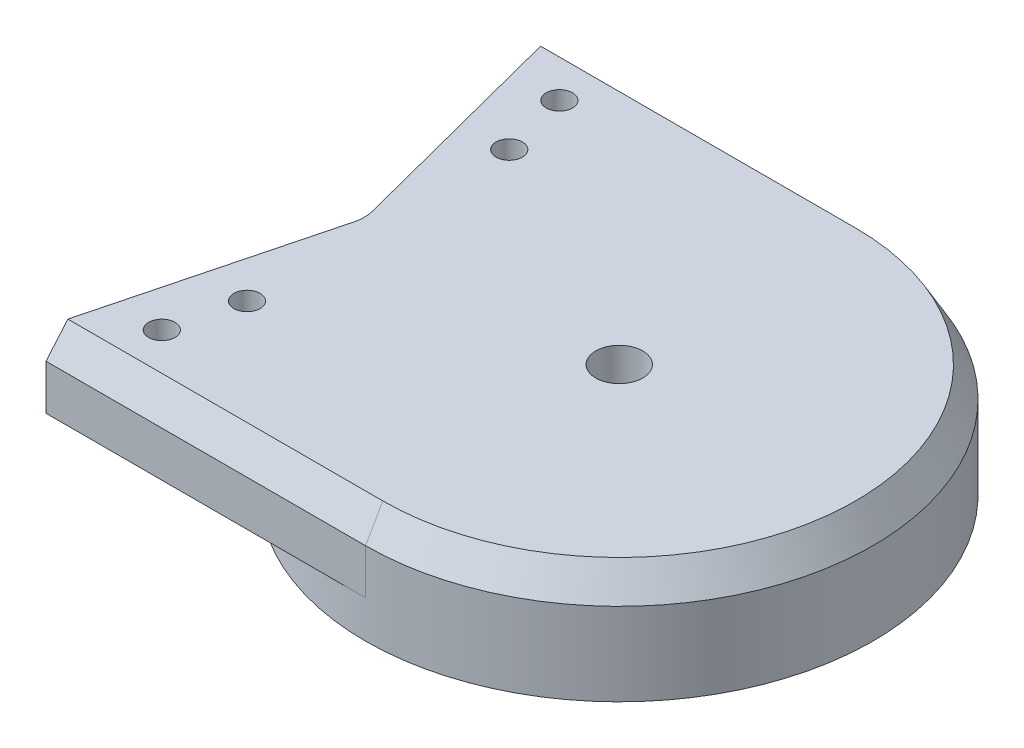
from build123d import *
from OCP.BRepFilletAPI import BRepFilletAPI_MakeChamfer

# Parameters (mm, degrees)
SALIENTE_EXTRUIR2_DEPTH     = 23
CROQUIS7_R                  = 20
CORTAR_EXTRUIR1_DEPTH       = 16
CROQUIS8_R                  = 10.25
CORTAR_EXTRUIR2_DEPTH       = 65.838641661
SALIENTE_EXTRUIR3_START     = 32
CROQUIS9_R                  = 20
CROQUIS9_R_2                = 3.075
CROQUIS9_R_3                = 10.25
SALIENTE_EXTRUIR3_DEPTH     = 32
CORTAR_EXTRUIR3_START       = -7
CROQUIS10_R                 = 20
CORTAR_EXTRUIR3_DEPTH       = 112.607172695
SALIENTE_EXTRUIR4_START     = 20
CROQUIS11_R                 = 3.075
CROQUIS11_R_2               = 20
SALIENTE_EXTRUIR4_DEPTH     = 20
CROQUIS12_R                 = 63
CORTAR_EXTRUIR4_DEPTH       = 3
CROQUIS13_R                 = 55
CORTAR_EXTRUIR5_DEPTH       = 10
SALIENTE_EXTRUIR5_START     = 10
SALIENTE_EXTRUIR5_DEPTH     = 10
CHAFL_N1_SIZE               = 8
CHAFL_N1_SIZE2              = 4.618802154
CROQUIS15_R                 = 6.25
CORTAR_EXTRUIR6_DEPTH       = 226.641862251
CORTAR_EXTRUIR7_REACH       = 233.334
CROQUIS17_R                 = 1.5
CORTAR_EXTRUIR9_REACH       = 225.907
CROQUIS19_R                 = 1.5
CORTAR_EXTRUIR10_START      = -50
CORTAR_EXTRUIR10_DEPTH      = 50
CORTAR_EXTRUIR11_DEPTH      = 50
CROQUIS22_R                 = 3
CORTAR_EXTRUIR12_DEPTH      = 3
CROQUIS23_R                 = 3
CORTAR_EXTRUIR13_DEPTH      = 3
CROQUIS25_R                 = 2.5
CORTAR_EXTRUIR15_DEPTH      = 30
CROQUIS24_R                 = 2.5
CORTAR_EXTRUIR14_DEPTH      = 30
CROQUIS26_R                 = 2
CORTAR_EXTRUIR16_DEPTH      = 223.070371729
CROQUIS27_R                 = 3.5
CORTAR_EXTRUIR17_DEPTH      = 5
CORTAR_EXTRUIR18_DEPTH      = 3.25
CORTAR_EXTRUIR20_DEPTH      = 223.070371729
CORTAR_EXTRUIR20_DEPTH_BACK = 10
CROQUIS31_R                 = 2.5
CORTAR_EXTRUIR21_DEPTH      = 217.079267863
CROQUIS32_R                 = 4.5
CORTAR_EXTRUIR22_DEPTH      = 5
SALIENTE_EXTRUIR6_START     = 4
CROQUIS33_R                 = 55
CROQUIS33_R_2               = 6.25
SALIENTE_EXTRUIR6_DEPTH     = 4
SALIENTE_EXTRUIR7_START     = 3.35
CROQUIS34_R                 = 16.85
CROQUIS34_R_2               = 6.25
SALIENTE_EXTRUIR7_DEPTH     = 3.35
SALIENTE_EXTRUIR8_START     = 29
CROQUIS35_R                 = 10
CROQUIS35_R_2               = 6.25
SALIENTE_EXTRUIR8_DEPTH     = 29
CORTAR_EXTRUIR23_DEPTH      = 218.721088781
CROQUIS37_R                 = 42.5
CROQUIS37_R_2               = 25
CORTAR_EXTRUIR24_DEPTH      = 8


with BuildPart() as part:
    # Croquis2 → Saliente-Extruir2 (new body)
    with BuildSketch(Plane(origin=(0, 0, 0), x_dir=(1, 0, 0), z_dir=(0, 1, 0))):
        with BuildLine():
            Line((32.725022686, -35), (-35, -35))
            Line((-35, -35), (-35, 35))
            Line((-35, 35), (38, 35))
            Line((38, 35), (52.182846342, -19.705264464))
            ThreePointArc((52.182846342, -19.705264464), (38.869791903, -20.762030653), (32.5, -32.5))
            ThreePointArc((32.5, -32.5), (32.556369153, -33.755053307), (32.725022686, -35))
        make_face()
    extrude(amount=SALIENTE_EXTRUIR2_DEPTH)

    # Croquis7 → Cortar-Extruir1 (cut)
    with BuildSketch(Plane(origin=(0, 23, 0), x_dir=(1, 0, 0), z_dir=(0, 1, 0))):
        with Locations(Location((1.5, -1.5, 0), (0, 0, 270))):
            Circle(CROQUIS7_R)
    extrude(amount=-CORTAR_EXTRUIR1_DEPTH, mode=Mode.SUBTRACT)

    # Croquis8 → Cortar-Extruir2 (cut, through all)
    with BuildSketch(Plane(origin=(0, 7, 0), x_dir=(1, 0, 0), z_dir=(0, 1, 0))):
        with Locations(Location((1.5, -1.5, 0), (0, 0, 270))):
            Circle(CROQUIS8_R)
    extrude(amount=-CORTAR_EXTRUIR2_DEPTH, mode=Mode.SUBTRACT)

    # Croquis9 → Saliente-Extruir3 (add)
    with BuildSketch(Plane(origin=(0, 23, 0), x_dir=(1, 0, 0), z_dir=(0, 1, 0)).offset(SALIENTE_EXTRUIR3_START)):
        with BuildLine():
            Line((-35, 35), (-35, -100))
            Line((-35, -100), (38, -100))
            Line((38, -100), (54.849357366, -35.009621588))
            ThreePointArc((54.849357366, -35.009621588), (55.169388384, -32.5), (54.849357366, -29.990378412))
            Line((54.849357366, -29.990378412), (38, 35))
            Line((38, 35), (-35, 35))
        make_face()
        with Locations(Location((1.5, -1.5, 0), (0, 0, 270))):
            Circle(CROQUIS9_R, mode=Mode.SUBTRACT)
        with Locations(Location((46.5, -32.5, 0), (0, 0, 270))):
            Circle(CROQUIS9_R_2, mode=Mode.SUBTRACT)
        with Locations(Location((1.5, -63.5, 0), (0, 0, 90))):
            Circle(CROQUIS9_R_3, mode=Mode.SUBTRACT)
    extrude(amount=-SALIENTE_EXTRUIR3_DEPTH)

    # Croquis10 → Cortar-Extruir3 (cut, through all)
    with BuildSketch(Plane.XZ.offset(-23).offset(CORTAR_EXTRUIR3_START)):
        with Locations(Location((1.5, 63.5, 0), (0, 0, 90))):
            Circle(CROQUIS10_R)
    extrude(amount=-CORTAR_EXTRUIR3_DEPTH, mode=Mode.SUBTRACT)

    # Croquis11 → Saliente-Extruir4 (add)
    with BuildSketch(Plane(origin=(0, 55, 0), x_dir=(1, 0, 0), z_dir=(0, 1, 0)).offset(SALIENTE_EXTRUIR4_START)):
        with BuildLine():
            Line((123, 35), (-35, 35))
            Line((-35, 35), (-35, -100))
            Line((-35, -100), (123, -100))
            ThreePointArc((123, -100), (190.5, -32.5), (123, 35))
        make_face()
        with Locations(Location((46.5, -32.5, 0), (0, 0, 270))):
            Circle(CROQUIS11_R, mode=Mode.SUBTRACT)
        with Locations(Location((1.5, -63.5, 0), (0, 0, 270))):
            Circle(CROQUIS11_R_2, mode=Mode.SUBTRACT)
        with Locations(Location((1.5, -1.5, 0), (0, 0, 270))):
            Circle(CROQUIS11_R_2, mode=Mode.SUBTRACT)
    extrude(amount=-SALIENTE_EXTRUIR4_DEPTH)

    # Croquis12 → Cortar-Extruir4 (cut)
    with BuildSketch(Plane.XZ.offset(-55)):
        with Locations(Location((123, 32.5, 0), (0, 0, 270))):
            Circle(CROQUIS12_R)
    extrude(amount=-CORTAR_EXTRUIR4_DEPTH, mode=Mode.SUBTRACT)

    # Croquis13 → Cortar-Extruir5 (cut)
    with BuildSketch(Plane.XZ.offset(-58)):
        with Locations(Location((123, 32.5, 0), (0, 0, 270))):
            Circle(CROQUIS13_R)
    extrude(amount=-CORTAR_EXTRUIR5_DEPTH, mode=Mode.SUBTRACT)

    # Croquis14 → Saliente-Extruir5 (add)
    with BuildSketch(Plane(origin=(0, 75, 0), x_dir=(1, 0, 0), z_dir=(0, 1, 0)).offset(SALIENTE_EXTRUIR5_START)):
        with BuildLine():
            Line((-35, -100), (123, -100))
            ThreePointArc((123, -100), (190.5, -32.5), (123, 35))
            Line((123, 35), (-35, 35))
            Line((-35, 35), (-35, -100))
        make_face()
    extrude(amount=-SALIENTE_EXTRUIR5_DEPTH)

    # Chaflán1: one chamfer whose edges measure the first distance from different faces: ONE call of the kernel's chamfer builder (chamfer() names one face for all edges)
    chafl_n1_edges_1 = [part.edges().sort_by_distance(p)[0] for p in [
        (190.5, 85, 32.5),
    ]]
    chafl_n1_side_1 = [part.faces().sort_by_distance(p)[0] for p in [
        (190.5, 70, 32.5),
    ]]
    chafl_n1_edges_2 = [part.edges().sort_by_distance(p)[0] for p in [
        (44, 85, -35),
    ]]
    chafl_n1_side_2 = [part.faces().sort_by_distance(p)[0] for p in [
        (24.509708738, 50.509708738, -35),
    ]]
    chafl_n1_edges_3 = [part.edges().sort_by_distance(p)[0] for p in [
        (44, 85, 100),
    ]]
    chafl_n1_side_3 = [part.faces().sort_by_distance(p)[0] for p in [
        (29.969474279, 59.765969474, 100),
    ]]
    chafl_n1 = BRepFilletAPI_MakeChamfer(part.part.solid().wrapped)
    for e in chafl_n1_edges_1:
        chafl_n1.Add(CHAFL_N1_SIZE, CHAFL_N1_SIZE2, e.wrapped, chafl_n1_side_1[0].wrapped)  # the first distance lies on this face
    for e in chafl_n1_edges_2:
        chafl_n1.Add(CHAFL_N1_SIZE, CHAFL_N1_SIZE2, e.wrapped, chafl_n1_side_2[0].wrapped)  # the first distance lies on this face
    for e in chafl_n1_edges_3:
        chafl_n1.Add(CHAFL_N1_SIZE, CHAFL_N1_SIZE2, e.wrapped, chafl_n1_side_3[0].wrapped)  # the first distance lies on this face
    add(Compound.cast(chafl_n1.Shape()), mode=Mode.REPLACE)

    # Croquis15 → Cortar-Extruir6 (cut, through all)
    with BuildSketch(Plane.XZ.offset(-68)):
        with Locations(Location((123, 32.5, 0), (0, 0, 270))):
            Circle(CROQUIS15_R)
    extrude(amount=-CORTAR_EXTRUIR6_DEPTH, mode=Mode.SUBTRACT)

    # Croquis17 → Cortar-Extruir7 (cut, up to next)
    with BuildSketch(Plane.XZ, mode=Mode.PRIVATE) as cortar_extruir7_sk1:
        with Locations(Location((16.5, 1.5, 0), (0, 0, 270))):
            Circle(CROQUIS17_R)
    cortar_extruir7_tool1 = extrude(cortar_extruir7_sk1.sketch, amount=-CORTAR_EXTRUIR7_REACH, mode=Mode.PRIVATE) & part.part
    # Croquis17 → Cortar-Extruir7 (cut, up to next)
    with BuildSketch(Plane.XZ, mode=Mode.PRIVATE) as cortar_extruir7_sk2:
        with Locations(Location((-6, -11.490381057, 0), (0, 0, 270))):
            Circle(CROQUIS17_R)
    cortar_extruir7_tool2 = extrude(cortar_extruir7_sk2.sketch, amount=-CORTAR_EXTRUIR7_REACH, mode=Mode.PRIVATE) & part.part
    # Croquis17 → Cortar-Extruir7 (cut, up to next)
    with BuildSketch(Plane.XZ, mode=Mode.PRIVATE) as cortar_extruir7_sk3:
        with Locations(Location((-6, 14.490381057, 0), (0, 0, 270))):
            Circle(CROQUIS17_R)
    cortar_extruir7_tool3 = extrude(cortar_extruir7_sk3.sketch, amount=-CORTAR_EXTRUIR7_REACH, mode=Mode.PRIVATE) & part.part
    # Croquis17 → Cortar-Extruir7 (cut, up to next)
    with BuildSketch(Plane.XZ, mode=Mode.PRIVATE) as cortar_extruir7_sk4:
        with Locations(Location((13.624355653, 8.5, 0), (0, 0, 270))):
            Circle(CROQUIS17_R)
    cortar_extruir7_tool4 = extrude(cortar_extruir7_sk4.sketch, amount=-CORTAR_EXTRUIR7_REACH, mode=Mode.PRIVATE) & part.part
    # Croquis17 → Cortar-Extruir7 (cut, up to next)
    with BuildSketch(Plane.XZ, mode=Mode.PRIVATE) as cortar_extruir7_sk5:
        with Locations(Location((1.5, -12.5, 0), (0, 0, 270))):
            Circle(CROQUIS17_R)
    cortar_extruir7_tool5 = extrude(cortar_extruir7_sk5.sketch, amount=-CORTAR_EXTRUIR7_REACH, mode=Mode.PRIVATE) & part.part
    # Croquis17 → Cortar-Extruir7 (cut, up to next)
    with BuildSketch(Plane.XZ, mode=Mode.PRIVATE) as cortar_extruir7_sk6:
        with Locations(Location((-10.624355653, 8.5, 0), (0, 0, 270))):
            Circle(CROQUIS17_R)
    cortar_extruir7_tool6 = extrude(cortar_extruir7_sk6.sketch, amount=-CORTAR_EXTRUIR7_REACH, mode=Mode.PRIVATE) & part.part
    add(cortar_extruir7_tool1.solids().sort_by_distance((16.5, 0, 1.5))[0], mode=Mode.SUBTRACT)
    add(cortar_extruir7_tool2.solids().sort_by_distance((-6, 0, -11.490381))[0], mode=Mode.SUBTRACT)
    add(cortar_extruir7_tool3.solids().sort_by_distance((-6, 0, 14.490381))[0], mode=Mode.SUBTRACT)
    add(cortar_extruir7_tool4.solids().sort_by_distance((13.624356, 0, 8.5))[0], mode=Mode.SUBTRACT)
    add(cortar_extruir7_tool5.solids().sort_by_distance((1.5, 0, -12.5))[0], mode=Mode.SUBTRACT)
    add(cortar_extruir7_tool6.solids().sort_by_distance((-10.624356, 0, 8.5))[0], mode=Mode.SUBTRACT)

    # Croquis19 → Cortar-Extruir9 (cut, up to next)
    with BuildSketch(Plane.XZ.offset(-23), mode=Mode.PRIVATE) as cortar_extruir9_sk1:
        with Locations(Location((16.5, 63.5, 0), (0, 0, 270))):
            Circle(CROQUIS19_R)
    cortar_extruir9_tool1 = extrude(cortar_extruir9_sk1.sketch, amount=-CORTAR_EXTRUIR9_REACH, mode=Mode.PRIVATE) & part.part
    # Croquis19 → Cortar-Extruir9 (cut, up to next)
    with BuildSketch(Plane.XZ.offset(-23), mode=Mode.PRIVATE) as cortar_extruir9_sk2:
        with Locations(Location((-6, 50.509618943, 0), (0, 0, 270))):
            Circle(CROQUIS19_R)
    cortar_extruir9_tool2 = extrude(cortar_extruir9_sk2.sketch, amount=-CORTAR_EXTRUIR9_REACH, mode=Mode.PRIVATE) & part.part
    # Croquis19 → Cortar-Extruir9 (cut, up to next)
    with BuildSketch(Plane.XZ.offset(-23), mode=Mode.PRIVATE) as cortar_extruir9_sk3:
        with Locations(Location((-6, 76.490381057, 0), (0, 0, 270))):
            Circle(CROQUIS19_R)
    cortar_extruir9_tool3 = extrude(cortar_extruir9_sk3.sketch, amount=-CORTAR_EXTRUIR9_REACH, mode=Mode.PRIVATE) & part.part
    # Croquis19 → Cortar-Extruir9 (cut, up to next)
    with BuildSketch(Plane.XZ.offset(-23), mode=Mode.PRIVATE) as cortar_extruir9_sk4:
        with Locations(Location((13.624355653, 70.5, 0), (0, 0, 270))):
            Circle(CROQUIS19_R)
    cortar_extruir9_tool4 = extrude(cortar_extruir9_sk4.sketch, amount=-CORTAR_EXTRUIR9_REACH, mode=Mode.PRIVATE) & part.part
    # Croquis19 → Cortar-Extruir9 (cut, up to next)
    with BuildSketch(Plane.XZ.offset(-23), mode=Mode.PRIVATE) as cortar_extruir9_sk5:
        with Locations(Location((1.5, 49.5, 0), (0, 0, 270))):
            Circle(CROQUIS19_R)
    cortar_extruir9_tool5 = extrude(cortar_extruir9_sk5.sketch, amount=-CORTAR_EXTRUIR9_REACH, mode=Mode.PRIVATE) & part.part
    # Croquis19 → Cortar-Extruir9 (cut, up to next)
    with BuildSketch(Plane.XZ.offset(-23), mode=Mode.PRIVATE) as cortar_extruir9_sk6:
        with Locations(Location((-10.624355653, 70.5, 0), (0, 0, 270))):
            Circle(CROQUIS19_R)
    cortar_extruir9_tool6 = extrude(cortar_extruir9_sk6.sketch, amount=-CORTAR_EXTRUIR9_REACH, mode=Mode.PRIVATE) & part.part
    add(cortar_extruir9_tool1.solids().sort_by_distance((16.5, 23, 63.5))[0], mode=Mode.SUBTRACT)
    add(cortar_extruir9_tool2.solids().sort_by_distance((-6, 23, 50.509619))[0], mode=Mode.SUBTRACT)
    add(cortar_extruir9_tool3.solids().sort_by_distance((-6, 23, 76.490381))[0], mode=Mode.SUBTRACT)
    add(cortar_extruir9_tool4.solids().sort_by_distance((13.624356, 23, 70.5))[0], mode=Mode.SUBTRACT)
    add(cortar_extruir9_tool5.solids().sort_by_distance((1.5, 23, 49.5))[0], mode=Mode.SUBTRACT)
    add(cortar_extruir9_tool6.solids().sort_by_distance((-10.624356, 23, 70.5))[0], mode=Mode.SUBTRACT)

    # Croquis20 → Cortar-Extruir10 (cut)
    with BuildSketch(Plane.XZ.offset(CORTAR_EXTRUIR10_START)):
        with BuildLine():
            Line((42.3656995, 5.747113524), (39.773106907, -4.252886476))
            ThreePointArc((39.773106907, -4.252886476), (38.705054743, -5.872620854), (36.869116213, -6.5))
            Line((36.869116213, -6.5), (19.83030278, -6.5))
            ThreePointArc((19.83030278, -6.5), (21.5, 1.5), (19.83030278, 9.5))
            Line((19.83030278, 9.5), (39.461708805, 9.5))
            ThreePointArc((39.461708805, 9.5), (41.834329659, 8.33593853), (42.3656995, 5.747113524))
        make_face()
    extrude(amount=CORTAR_EXTRUIR10_DEPTH, mode=Mode.SUBTRACT)

    # Croquis21 → Cortar-Extruir11 (cut)
    with BuildSketch(Plane.XZ.offset(-23)):
        with BuildLine():
            Line((39.461708805, 55.5), (19.83030278, 55.5))
            ThreePointArc((19.83030278, 55.5), (21.5, 63.5), (19.83030278, 71.5))
            Line((19.83030278, 71.5), (36.869116213, 71.5))
            ThreePointArc((36.869116213, 71.5), (38.705054743, 70.872620854), (39.773106907, 69.252886476))
            Line((39.773106907, 69.252886476), (42.3656995, 59.252886476))
            ThreePointArc((42.3656995, 59.252886476), (41.834329659, 56.66406147), (39.461708805, 55.5))
        make_face()
    extrude(amount=-CORTAR_EXTRUIR11_DEPTH, mode=Mode.SUBTRACT)

    # Croquis22 → Cortar-Extruir12 (cut)
    with BuildSketch(Plane.XZ):
        with Locations(Location((-6, 14.490381057, 0), (0, 0, 270))):
            Circle(CROQUIS22_R)
        with Locations(Location((-10.624355653, 8.5, 0), (0, 0, 270))):
            Circle(CROQUIS22_R)
        with Locations(Location((-6, -11.490381057, 0), (0, 0, 270))):
            Circle(CROQUIS22_R)
        with Locations(Location((1.5, -12.5, 0), (0, 0, 270))):
            Circle(CROQUIS22_R)
        with Locations(Location((16.5, 1.5, 0), (0, 0, 270))):
            Circle(CROQUIS22_R)
        with Locations(Location((13.624355653, 8.5, 0), (0, 0, 270))):
            Circle(CROQUIS22_R)
    extrude(amount=-CORTAR_EXTRUIR12_DEPTH, mode=Mode.SUBTRACT)

    # Croquis23 → Cortar-Extruir13 (cut)
    with BuildSketch(Plane.XZ.offset(-23)):
        with Locations(Location((-6, 76.490381057, 0), (0, 0, 270))):
            Circle(CROQUIS23_R)
        with Locations(Location((-10.624355653, 70.5, 0), (0, 0, 270))):
            Circle(CROQUIS23_R)
        with Locations(Location((-6, 50.509618943, 0), (0, 0, 270))):
            Circle(CROQUIS23_R)
        with Locations(Location((1.5, 49.5, 0), (0, 0, 270))):
            Circle(CROQUIS23_R)
        with Locations(Location((16.5, 63.5, 0), (0, 0, 270))):
            Circle(CROQUIS23_R)
        with Locations(Location((13.624355653, 70.5, 0), (0, 0, 270))):
            Circle(CROQUIS23_R)
    extrude(amount=-CORTAR_EXTRUIR13_DEPTH, mode=Mode.SUBTRACT)

    # Croquis25 → Cortar-Extruir15 (cut)
    with BuildSketch(Plane.XZ.offset(-23)):
        with Locations(Location((-28.75, 63.5, 0), (0, 0, 270))):
            Circle(CROQUIS25_R)
        with Locations(Location((29, 47, 0), (0, 0, 270))):
            Circle(CROQUIS25_R)
    extrude(amount=-CORTAR_EXTRUIR15_DEPTH, mode=Mode.SUBTRACT)

    # Croquis24 → Cortar-Extruir14 (cut)
    with BuildSketch(Plane.XZ):
        with Locations(Location((-28.75, 1.5, 0), (0, 0, 270))):
            Circle(CROQUIS24_R)
        with Locations(Location((25, 25, 0), (0, 0, 270))):
            Circle(CROQUIS24_R)
    extrude(amount=-CORTAR_EXTRUIR14_DEPTH, mode=Mode.SUBTRACT)

    # Croquis26 → Cortar-Extruir16 (cut, through all)
    with BuildSketch(Plane.XZ.offset(-55)):
        with Locations(Location((54.186793756, 85.381197846, 0), (0, 0, 270))):
            Circle(CROQUIS26_R)
        with Locations(Location((58.853460423, 67.381197846, 0), (0, 0, 270))):
            Circle(CROQUIS26_R)
        with Locations(Location((58.853460423, -2.381197846, 0), (0, 0, 90))):
            Circle(CROQUIS26_R)
        with Locations(Location((54.186793756, -20.381197846, 0), (0, 0, 90))):
            Circle(CROQUIS26_R)
    extrude(amount=-CORTAR_EXTRUIR16_DEPTH, mode=Mode.SUBTRACT)

    # Croquis27 → Cortar-Extruir17 (cut)
    with BuildSketch(Plane(origin=(0, 85, 0), x_dir=(1, 0, 0), z_dir=(0, 1, 0))):
        with Locations(Location((54.186793756, 20.381197846, 0), (0, 0, 270))):
            Circle(CROQUIS27_R)
        with Locations(Location((58.853460423, 2.381197846, 0), (0, 0, 270))):
            Circle(CROQUIS27_R)
        with Locations(Location((58.853460423, -67.381197846, 0), (0, 0, 270))):
            Circle(CROQUIS27_R)
        with Locations(Location((54.186793756, -85.381197846, 0), (0, 0, 270))):
            Circle(CROQUIS27_R)
    extrude(amount=-CORTAR_EXTRUIR17_DEPTH, mode=Mode.SUBTRACT)

    # Croquis28 → Cortar-Extruir18 (cut)
    with BuildSketch(Plane.XZ.offset(-55)):
        Polygon((55.222779206, 81.385253968), (58.165375392, 84.280415625), (57.129389942, 88.276359503), (53.150808306, 89.377141725), (50.20821212, 86.481980068), (51.24419757, 82.48603619), align=None)
        Polygon((59.889445873, 63.385253968), (62.832042059, 66.280415625), (61.796056609, 70.276359503), (57.817474973, 71.377141725), (54.874878787, 68.481980068), (55.910864237, 64.48603619), align=None)
        Polygon((59.889445873, 1.614746032), (55.910864237, 0.51396381), (54.874878787, -3.481980068), (57.817474973, -6.377141725), (61.796056609, -5.276359503), (62.832042059, -1.280415625), align=None)
        Polygon((55.222779206, -16.385253968), (51.24419757, -17.48603619), (50.20821212, -21.481980068), (53.150808306, -24.377141725), (57.129389942, -23.276359503), (58.165375392, -19.280415625), align=None)
    extrude(amount=-CORTAR_EXTRUIR18_DEPTH, mode=Mode.SUBTRACT)

    # Croquis30 → Cortar-Extruir20 (cut, two sides: drawn at the far end of the back side and taken through both)
    with BuildSketch(Plane.XZ.offset(-55).offset(-CORTAR_EXTRUIR20_DEPTH_BACK)):
        with BuildLine():
            Line((123, 100), (-35, 100))
            Line((-35, 100), (-35, -35))
            Line((-35, -35), (123, -35))
            ThreePointArc((123, -35), (55.5, 32.5), (123, 100))
        make_face()
    extrude(amount=CORTAR_EXTRUIR20_DEPTH + CORTAR_EXTRUIR20_DEPTH_BACK, mode=Mode.SUBTRACT)

    # Croquis31 → Cortar-Extruir21 (cut, through all)
    with BuildSketch(Plane.XZ.offset(-65)):
        with Locations(Location((-22, 87, 0), (0, 0, 270))):
            Circle(CROQUIS31_R)
        with Locations(Location((25, 87, 0), (0, 0, 270))):
            Circle(CROQUIS31_R)
        with Locations(Location((25, -22, 0), (0, 0, 90))):
            Circle(CROQUIS31_R)
        with Locations(Location((-22, -22, 0), (0, 0, 90))):
            Circle(CROQUIS31_R)
    extrude(amount=-CORTAR_EXTRUIR21_DEPTH, mode=Mode.SUBTRACT)

    # Croquis32 → Cortar-Extruir22 (cut)
    with BuildSketch(Plane(origin=(0, 85, 0), x_dir=(1, 0, 0), z_dir=(0, 1, 0))):
        with Locations(Location((-22, 22, 0), (0, 0, 270))):
            Circle(CROQUIS32_R)
        with Locations(Location((25, 22, 0), (0, 0, 270))):
            Circle(CROQUIS32_R)
        with Locations(Location((-22, -87, 0), (0, 0, 270))):
            Circle(CROQUIS32_R)
        with Locations(Location((25, -87, 0), (0, 0, 270))):
            Circle(CROQUIS32_R)
    extrude(amount=-CORTAR_EXTRUIR22_DEPTH, mode=Mode.SUBTRACT)

    # Croquis33 → Saliente-Extruir6 (add)
    with BuildSketch(Plane.XZ.offset(-68).offset(SALIENTE_EXTRUIR6_START)):
        with Locations(Location((123, 32.5, 0), (0, 0, 270))):
            Circle(CROQUIS33_R)
        with Locations(Location((123, 32.5, 0), (0, 0, 270))):
            Circle(CROQUIS33_R_2, mode=Mode.SUBTRACT)
    extrude(amount=-SALIENTE_EXTRUIR6_DEPTH)

    # Croquis34 → Saliente-Extruir7 (add)
    with BuildSketch(Plane.XZ.offset(-64).offset(SALIENTE_EXTRUIR7_START)):
        with Locations(Location((123, 32.5, 0), (0, 0, 270))):
            Circle(CROQUIS34_R)
        with Locations(Location((123, 32.5, 0), (0, 0, 270))):
            Circle(CROQUIS34_R_2, mode=Mode.SUBTRACT)
    extrude(amount=-SALIENTE_EXTRUIR7_DEPTH)

    # Croquis35 → Saliente-Extruir8 (add)
    with BuildSketch(Plane.XZ.offset(-60.65).offset(SALIENTE_EXTRUIR8_START)):
        with Locations(Location((123, 32.5, 0), (0, 0, 90))):
            Circle(CROQUIS35_R)
        with Locations(Location((123, 32.5, 0), (0, 0, 270))):
            Circle(CROQUIS35_R_2, mode=Mode.SUBTRACT)
    extrude(amount=-SALIENTE_EXTRUIR8_DEPTH)

    # Croquis36 → Cortar-Extruir23 (cut, through all)
    with BuildSketch(Plane.XZ.offset(-65)):
        with BuildLine():
            Line((38, -35), (54.849357366, 29.990378412))
            ThreePointArc((54.849357366, 29.990378412), (55.169388384, 32.5), (54.849357366, 35.009621588))
            Line((54.849357366, 35.009621588), (38, 100))
            Line((38, 100), (-35, 100))
            Line((-35, 100), (-35, -35))
            Line((-35, -35), (38, -35))
        make_face()
    extrude(amount=-CORTAR_EXTRUIR23_DEPTH, mode=Mode.SUBTRACT)

    # Croquis37 → Cortar-Extruir24 (cut)
    with BuildSketch(Plane.XZ.offset(-64)):
        with Locations(Location((123, 32.5, 0), (0, 0, 270))):
            Circle(CROQUIS37_R)
        with Locations(Location((123, 32.5, 0), (0, 0, 270))):
            Circle(CROQUIS37_R_2, mode=Mode.SUBTRACT)
    extrude(amount=-CORTAR_EXTRUIR24_DEPTH, mode=Mode.SUBTRACT)


solid = part.part
